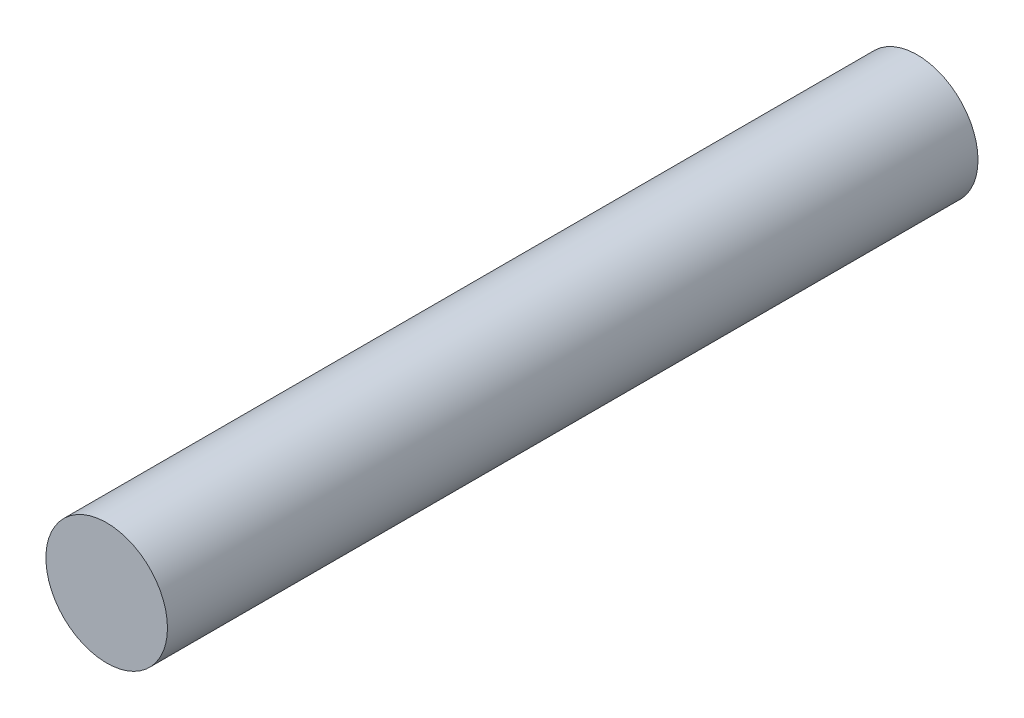
from build123d import *

# Parameters (mm, degrees)
ESQUISSE1_R        = 1.5
BOSS_EXTRU_1_DEPTH = 10


with BuildPart() as part:
    # Esquisse1 → Boss.-Extru.1 (new, symmetric)
    with BuildSketch(Plane.XY):
        Circle(ESQUISSE1_R)
    extrude(amount=BOSS_EXTRU_1_DEPTH, both=True)


solid = part.part
